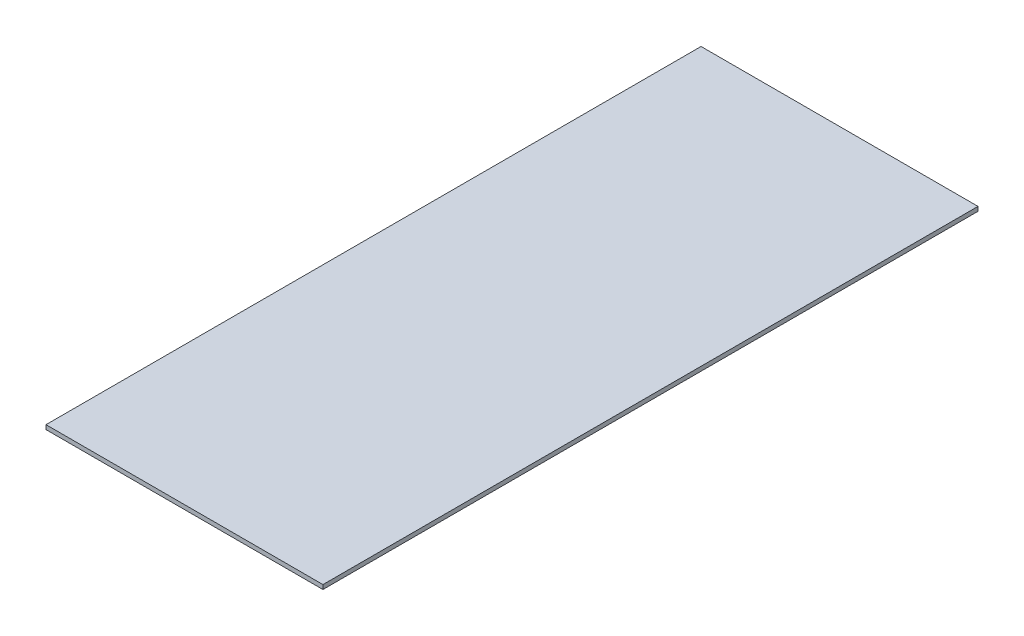
from build123d import *

# Parameters (mm, degrees)
SKETCH1_W           = 193.3
SKETCH1_H           = 457.2
BOSS_EXTRUDE1_DEPTH = 3


with BuildPart() as part:
    # Sketch1 → Boss-Extrude1 (new body)
    with BuildSketch(Plane(origin=(0, 0, 0), x_dir=(1, 0, 0), z_dir=(0, 1, 0))):
        Rectangle(SKETCH1_W, SKETCH1_H)
    extrude(amount=BOSS_EXTRUDE1_DEPTH)


solid = part.part
